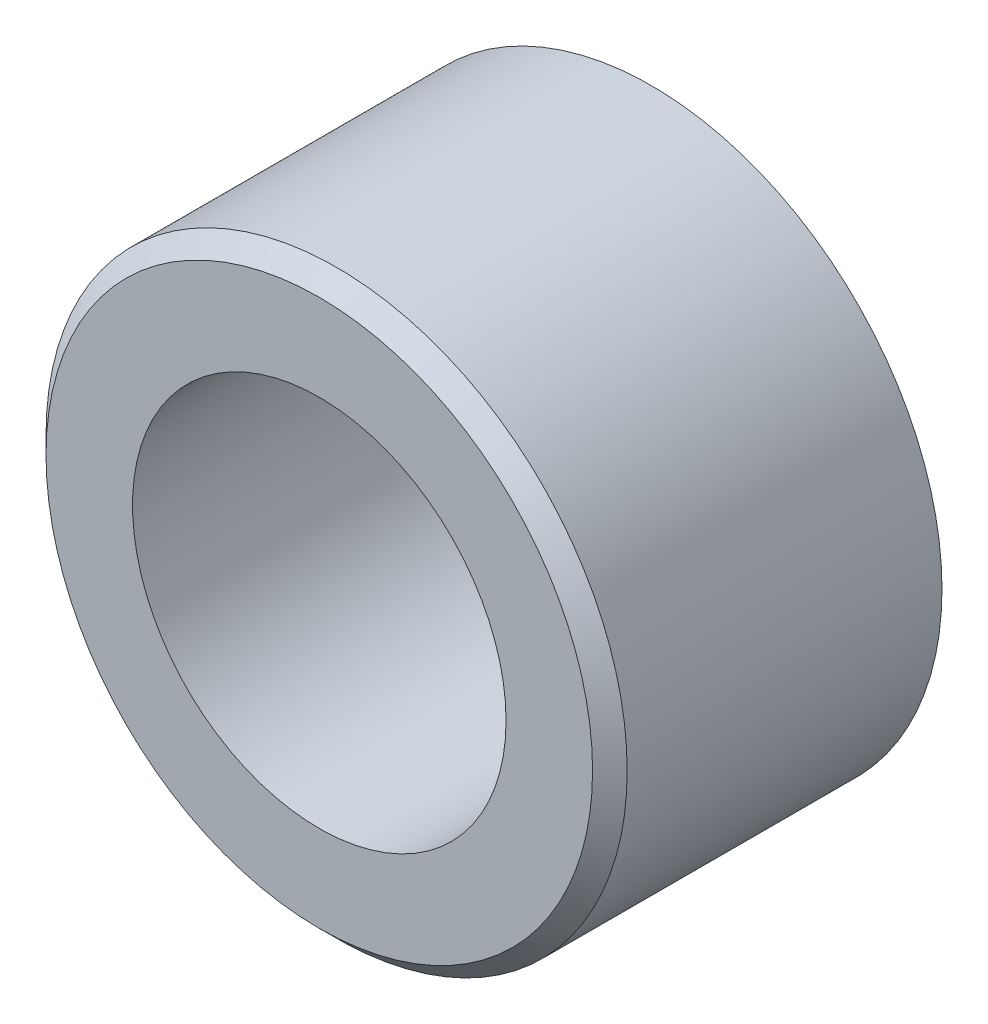
from build123d import *

# Parameters (mm, degrees)
SKETCH1_R      = 5.55625
SKETCH1_R_2    = 3.57124
EXTRUDE1_DEPTH = 3.175
CHAMFER1_SIZE  = 0.330835


with BuildPart() as part:
    # Sketch1 → Extrude1 (new, symmetric)
    with BuildSketch(Plane.XY):
        Circle(SKETCH1_R)
        Circle(SKETCH1_R_2, mode=Mode.SUBTRACT)
    extrude(amount=EXTRUDE1_DEPTH, both=True)

    # Chamfer1
    chamfer1_edges = [part.edges().sort_by_distance(p)[0] for p in [
        (-5.55625, 0, 3.175),
    ]]
    chamfer(chamfer1_edges, length=CHAMFER1_SIZE)


solid = part.part
